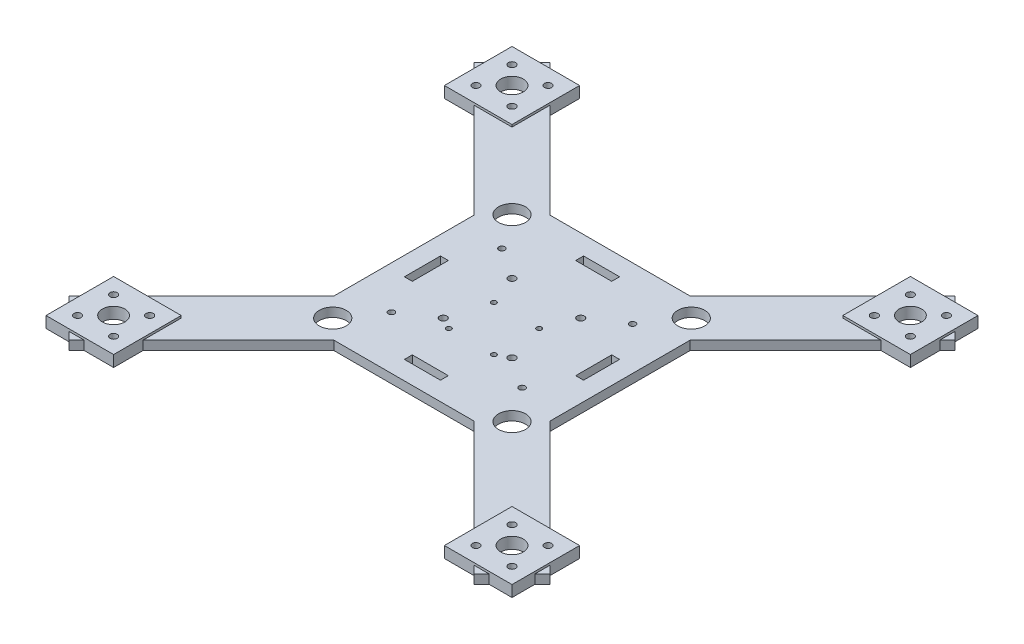
from build123d import *

# Parameters (mm, degrees)
SKETCH1_W            = 96
SKETCH1_H            = 96
CENTERDECK_DEPTH     = 4
ARM1_DEPTH           = 4
ARM2_DEPTH           = 4
ARM3_DEPTH           = 4
ARM4_DEPTH           = 4
SKETCH6_W            = 30
SKETCH6_H            = 30
MOTORPAD1_DEPTH      = 5
SKETCH7_W            = 30
SKETCH7_H            = 30
MOTORPAD2_DEPTH      = 5
SKETCH8_W            = 30
SKETCH8_H            = 30
MOTORPAD3_DEPTH      = 5
SKETCH9_W            = 30
SKETCH9_H            = 30
MOTORPAD4_DEPTH      = 5
SKETCH10_R           = 1.6
SKETCH10_R_2         = 5
MOTORHOLES1_DEPTH    = 152.082758778
SKETCH11_R           = 1.6
SKETCH11_R_2         = 5
MOTORHOLES2_DEPTH    = 152.082758778
SKETCH12_R           = 1.6
SKETCH12_R_2         = 5
MOTORHOLES3_DEPTH    = 152.082758778
SKETCH13_R           = 1.6
SKETCH13_R_2         = 5
MOTORHOLES4_DEPTH    = 152.082758778
SKETCH14_R           = 1.6
STACKHOLES_DEPTH     = 152.082758778
SKETCH15_R           = 1.35
PIHOLES_DEPTH        = 152.082758778
SKETCH16_W           = 3.5
SKETCH16_H           = 16
SKETCH16_W_2         = 16
SKETCH16_H_2         = 3.5
BATTSTRAPSLOTS_DEPTH = 152.082758778
SKETCH17_R           = 1.1
CAMERAHOLES_DEPTH    = 152.082758778
SKETCH18_R           = 6
ARMLIGHTENING_DEPTH  = 152.082758778


with BuildPart() as part:
    # Sketch1 → CenterDeck (new body)
    with BuildSketch(Plane(origin=(0, 0, 0), x_dir=(1, 0, 0), z_dir=(0, 1, 0))):
        Rectangle(SKETCH1_W, SKETCH1_H)
    extrude(amount=CENTERDECK_DEPTH)

    # Sketch2 → Arm1 (add)
    with BuildSketch(Plane(origin=(0, 0, 0), x_dir=(1, 0, 0), z_dir=(0, 1, 0))):
        Polygon((22.627416998, 39.597979746), (39.597979746, 22.627416998), (106.773123959, 89.802561211), (89.802561211, 106.773123959), align=None)
    extrude(amount=ARM1_DEPTH)

    # Sketch3 → Arm2 (add)
    with BuildSketch(Plane(origin=(0, 0, 0), x_dir=(1, 0, 0), z_dir=(0, 1, 0))):
        Polygon((39.597979746, -22.627416998), (22.627416998, -39.597979746), (89.802561211, -106.773123959), (106.773123959, -89.802561211), align=None)
    extrude(amount=ARM2_DEPTH)

    # Sketch4 → Arm3 (add)
    with BuildSketch(Plane(origin=(0, 0, 0), x_dir=(1, 0, 0), z_dir=(0, 1, 0))):
        Polygon((-39.597979746, 22.627416998), (-22.627416998, 39.597979746), (-89.802561211, 106.773123959), (-106.773123959, 89.802561211), align=None)
    extrude(amount=ARM3_DEPTH)

    # Sketch5 → Arm4 (add)
    with BuildSketch(Plane(origin=(0, 0, 0), x_dir=(1, 0, 0), z_dir=(0, 1, 0))):
        Polygon((-22.627416998, -39.597979746), (-39.597979746, -22.627416998), (-106.773123959, -89.802561211), (-89.802561211, -106.773123959), align=None)
    extrude(amount=ARM4_DEPTH)

    # Sketch6 → MotorPad1 (add)
    with BuildSketch(Plane(origin=(0, 0, 0), x_dir=(1, 0, 0), z_dir=(0, 1, 0))):
        with Locations((88.388347648, 88.388347648)):
            Rectangle(SKETCH6_W, SKETCH6_H)
    extrude(amount=MOTORPAD1_DEPTH)

    # Sketch7 → MotorPad2 (add)
    with BuildSketch(Plane(origin=(0, 0, 0), x_dir=(1, 0, 0), z_dir=(0, 1, 0))):
        with Locations((88.388347648, -88.388347648)):
            Rectangle(SKETCH7_W, SKETCH7_H)
    extrude(amount=MOTORPAD2_DEPTH)

    # Sketch8 → MotorPad3 (add)
    with BuildSketch(Plane(origin=(0, 0, 0), x_dir=(1, 0, 0), z_dir=(0, 1, 0))):
        with Locations((-88.388347648, 88.388347648)):
            Rectangle(SKETCH8_W, SKETCH8_H)
    extrude(amount=MOTORPAD3_DEPTH)

    # Sketch9 → MotorPad4 (add)
    with BuildSketch(Plane(origin=(0, 0, 0), x_dir=(1, 0, 0), z_dir=(0, 1, 0))):
        with Locations((-88.388347648, -88.388347648)):
            Rectangle(SKETCH9_W, SKETCH9_H)
    extrude(amount=MOTORPAD4_DEPTH)

    # Sketch10 → MotorHoles1 (cut, through all)
    with BuildSketch(Plane(origin=(0, 0, 0), x_dir=(1, 0, 0), z_dir=(0, 1, 0))):
        with Locations(Location((96.388347648, 96.388347648, 0), (0, 0, 270))):
            Circle(SKETCH10_R)
        with Locations(Location((96.388347648, 80.388347648, 0), (0, 0, 270))):
            Circle(SKETCH10_R)
        with Locations(Location((80.388347648, 96.388347648, 0), (0, 0, 270))):
            Circle(SKETCH10_R)
        with Locations(Location((80.388347648, 80.388347648, 0), (0, 0, 270))):
            Circle(SKETCH10_R)
        with Locations(Location((88.388347648, 88.388347648, 0), (0, 0, 270))):
            Circle(SKETCH10_R_2)
    extrude(amount=MOTORHOLES1_DEPTH, mode=Mode.SUBTRACT)

    # Sketch11 → MotorHoles2 (cut, through all)
    with BuildSketch(Plane(origin=(0, 0, 0), x_dir=(1, 0, 0), z_dir=(0, 1, 0))):
        with Locations(Location((96.388347648, -80.388347648, 0), (0, 0, 270))):
            Circle(SKETCH11_R)
        with Locations(Location((96.388347648, -96.388347648, 0), (0, 0, 270))):
            Circle(SKETCH11_R)
        with Locations(Location((80.388347648, -80.388347648, 0), (0, 0, 270))):
            Circle(SKETCH11_R)
        with Locations(Location((80.388347648, -96.388347648, 0), (0, 0, 270))):
            Circle(SKETCH11_R)
        with Locations(Location((88.388347648, -88.388347648, 0), (0, 0, 270))):
            Circle(SKETCH11_R_2)
    extrude(amount=MOTORHOLES2_DEPTH, mode=Mode.SUBTRACT)

    # Sketch12 → MotorHoles3 (cut, through all)
    with BuildSketch(Plane(origin=(0, 0, 0), x_dir=(1, 0, 0), z_dir=(0, 1, 0))):
        with Locations(Location((-80.388347648, 96.388347648, 0), (0, 0, 270))):
            Circle(SKETCH12_R)
        with Locations(Location((-80.388347648, 80.388347648, 0), (0, 0, 270))):
            Circle(SKETCH12_R)
        with Locations(Location((-96.388347648, 96.388347648, 0), (0, 0, 270))):
            Circle(SKETCH12_R)
        with Locations(Location((-96.388347648, 80.388347648, 0), (0, 0, 270))):
            Circle(SKETCH12_R)
        with Locations(Location((-88.388347648, 88.388347648, 0), (0, 0, 270))):
            Circle(SKETCH12_R_2)
    extrude(amount=MOTORHOLES3_DEPTH, mode=Mode.SUBTRACT)

    # Sketch13 → MotorHoles4 (cut, through all)
    with BuildSketch(Plane(origin=(0, 0, 0), x_dir=(1, 0, 0), z_dir=(0, 1, 0))):
        with Locations(Location((-80.388347648, -80.388347648, 0), (0, 0, 270))):
            Circle(SKETCH13_R)
        with Locations(Location((-80.388347648, -96.388347648, 0), (0, 0, 270))):
            Circle(SKETCH13_R)
        with Locations(Location((-96.388347648, -80.388347648, 0), (0, 0, 270))):
            Circle(SKETCH13_R)
        with Locations(Location((-96.388347648, -96.388347648, 0), (0, 0, 270))):
            Circle(SKETCH13_R)
        with Locations(Location((-88.388347648, -88.388347648, 0), (0, 0, 270))):
            Circle(SKETCH13_R_2)
    extrude(amount=MOTORHOLES4_DEPTH, mode=Mode.SUBTRACT)

    # Sketch14 → StackHoles (cut, through all)
    with BuildSketch(Plane(origin=(0, 0, 0), x_dir=(1, 0, 0), z_dir=(0, 1, 0))):
        with Locations(Location((15.25, 15.25, 0), (0, 0, 270))):
            Circle(SKETCH14_R)
        with Locations(Location((15.25, -15.25, 0), (0, 0, 270))):
            Circle(SKETCH14_R)
        with Locations(Location((-15.25, 15.25, 0), (0, 0, 270))):
            Circle(SKETCH14_R)
        with Locations(Location((-15.25, -15.25, 0), (0, 0, 270))):
            Circle(SKETCH14_R)
    extrude(amount=STACKHOLES_DEPTH, mode=Mode.SUBTRACT)

    # Sketch15 → PiHoles (cut, through all)
    with BuildSketch(Plane(origin=(0, 0, 0), x_dir=(1, 0, 0), z_dir=(0, 1, 0))):
        with Locations(Location((29, 24.5, 0), (0, 0, 270))):
            Circle(SKETCH15_R)
        with Locations(Location((29, -24.5, 0), (0, 0, 270))):
            Circle(SKETCH15_R)
        with Locations(Location((-29, 24.5, 0), (0, 0, 270))):
            Circle(SKETCH15_R)
        with Locations(Location((-29, -24.5, 0), (0, 0, 270))):
            Circle(SKETCH15_R)
    extrude(amount=PIHOLES_DEPTH, mode=Mode.SUBTRACT)

    # Sketch16 → BattStrapSlots (cut, through all)
    with BuildSketch(Plane(origin=(0, 0, 0), x_dir=(1, 0, 0), z_dir=(0, 1, 0))):
        with Locations((-38, 0)):
            Rectangle(SKETCH16_W, SKETCH16_H)
        with Locations((38, 0)):
            Rectangle(SKETCH16_W, SKETCH16_H)
        with Locations((0, 38)):
            Rectangle(SKETCH16_W_2, SKETCH16_H_2)
        with Locations((0, -38)):
            Rectangle(SKETCH16_W_2, SKETCH16_H_2)
    extrude(amount=BATTSTRAPSLOTS_DEPTH, mode=Mode.SUBTRACT)

    # Sketch17 → CameraHoles (cut, through all)
    with BuildSketch(Plane(origin=(0, 0, 0), x_dir=(1, 0, 0), z_dir=(0, 1, 0))):
        with Locations(Location((10, 2, 0), (0, 0, 270))):
            Circle(SKETCH17_R)
        with Locations(Location((10, -18, 0), (0, 0, 270))):
            Circle(SKETCH17_R)
        with Locations(Location((-10, 2, 0), (0, 0, 270))):
            Circle(SKETCH17_R)
        with Locations(Location((-10, -18, 0), (0, 0, 270))):
            Circle(SKETCH17_R)
    extrude(amount=CAMERAHOLES_DEPTH, mode=Mode.SUBTRACT)

    # Sketch18 → ArmLightening (cut, through all)
    with BuildSketch(Plane(origin=(0, 0, 0), x_dir=(1, 0, 0), z_dir=(0, 1, 0))):
        with Locations(Location((39.774756442, 39.774756442, 0), (0, 0, 270))):
            Circle(SKETCH18_R)
        with Locations(Location((39.774756442, -39.774756442, 0), (0, 0, 270))):
            Circle(SKETCH18_R)
        with Locations(Location((-39.774756442, 39.774756442, 0), (0, 0, 270))):
            Circle(SKETCH18_R)
        with Locations(Location((-39.774756442, -39.774756442, 0), (0, 0, 270))):
            Circle(SKETCH18_R)
    extrude(amount=ARMLIGHTENING_DEPTH, mode=Mode.SUBTRACT)


solid = part.part
